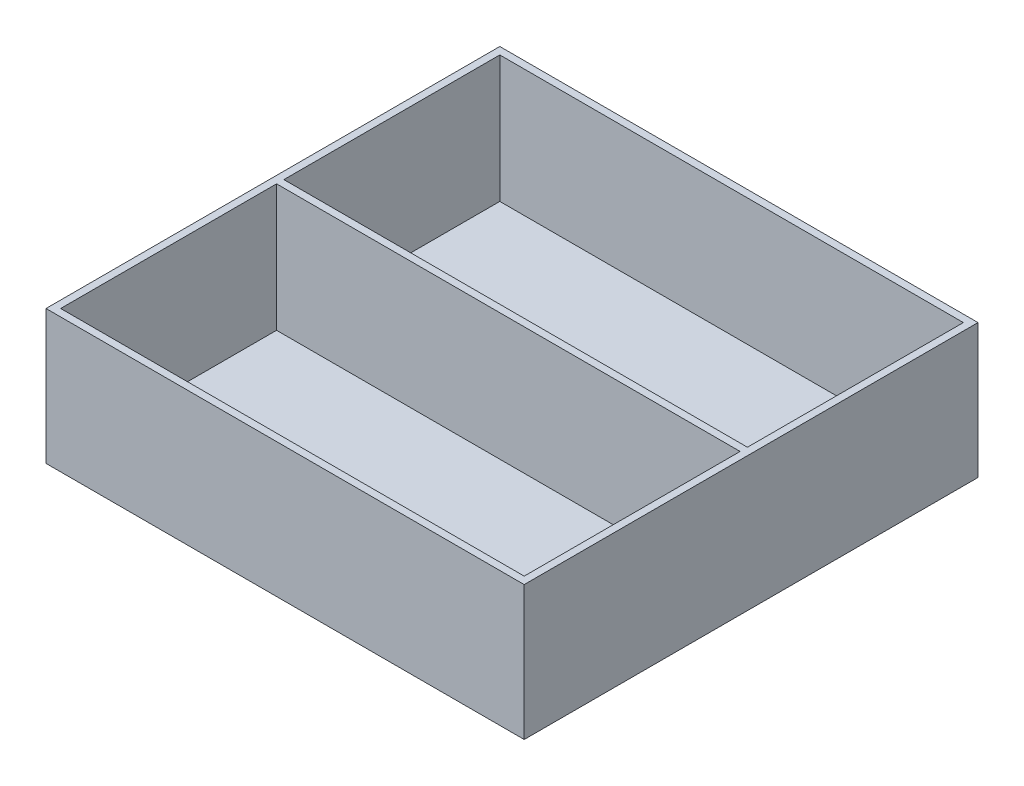
from build123d import *

# Parameters (mm, degrees)
SKETCH1_W           = 196
SKETCH1_H           = 186
BOSS_EXTRUDE1_DEPTH = 55
SKETCH2_W           = 190
SKETCH2_H           = 88.5
CUT_EXTRUDE1_DEPTH  = 52


with BuildPart() as part:
    # Sketch1 → Boss-Extrude1 (new body)
    with BuildSketch(Plane(origin=(0, 0, 0), x_dir=(1, 0, 0), z_dir=(0, 1, 0))):
        Rectangle(SKETCH1_W, SKETCH1_H)
    extrude(amount=BOSS_EXTRUDE1_DEPTH)

    # Sketch2 → Cut-Extrude1 (cut)
    with BuildSketch(Plane(origin=(0, 55, 0), x_dir=(1, 0, 0), z_dir=(0, 1, 0))):
        with Locations((0, -45.75)):
            Rectangle(SKETCH2_W, SKETCH2_H)
        with Locations((0, 45.75)):
            Rectangle(SKETCH2_W, SKETCH2_H)
    extrude(amount=-CUT_EXTRUDE1_DEPTH, mode=Mode.SUBTRACT)


solid = part.part
